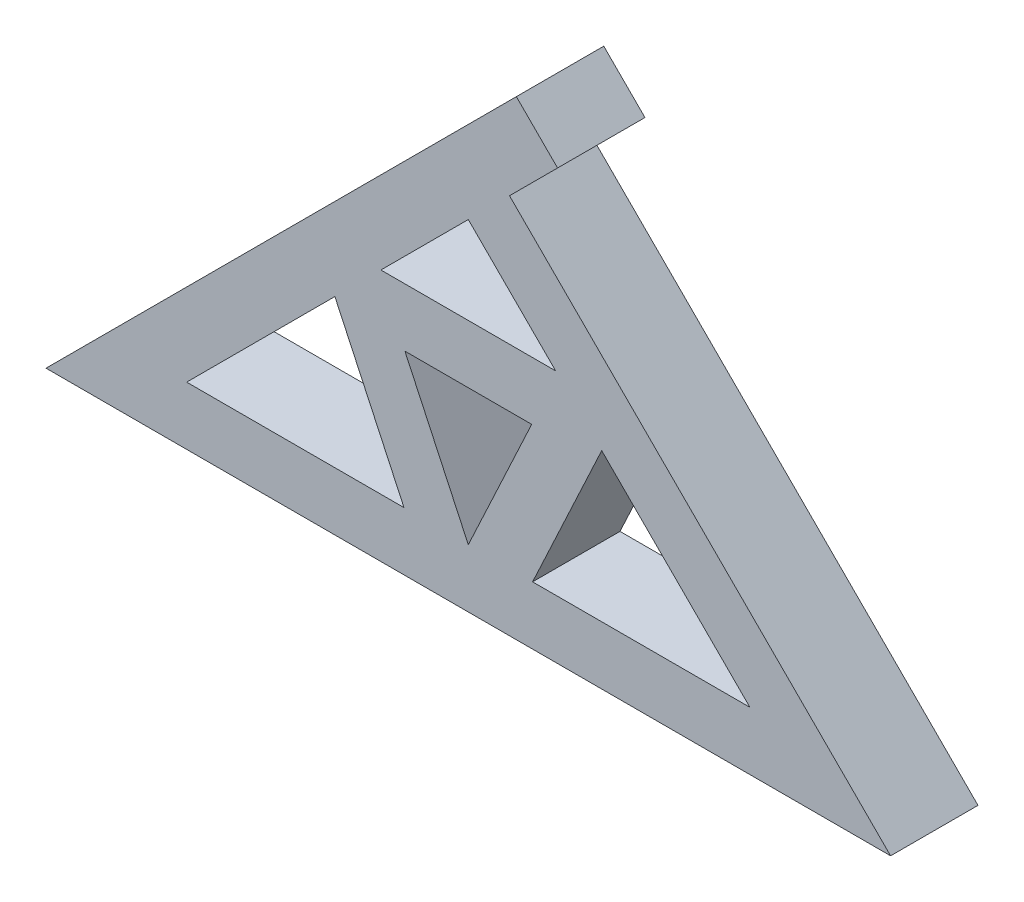
from build123d import *

# Parameters (mm, degrees)
BOSS_EXTRUDE1_DEPTH     = 9
SKETCH2_R               = 1.625
CUT_EXTRUDE3_DEPTH      = 9
SKETCH8_W               = 9
SKETCH8_H               = 7
SKETCH8_R               = 1.625
BOSS_EXTRUDE2_DEPTH     = 6
CUT_EXTRUDE4_DEPTH      = 33
CUT_EXTRUDE4_DEPTH_BACK = 3
SKETCH9_R               = 2.875


with BuildPart() as part:
    # Sketch1 → Boss-Extrude1 (new body)
    # profile 1 of 3: a face of its own
    with BuildSketch(Plane.XY):
        Polygon((86.974134086, 0), (43.487067043, 43.487067043), (0, 0), align=None)
        Polygon((43.487067043, 35.001785669), (72.488852712, 6), (14.485281374, 6), align=None, mode=Mode.SUBTRACT)
    # profile 2 of 3: a face of its own
    with BuildSketch(Plane.XY):
        Polygon((34.487067043, 26.001785669), (29.749143655, 21.263862281), (36.866799529, 6), (43.487067043, 6), (36.957927158, 20.001785669), (43.487067043, 20.001785669), (43.487067043, 26.001785669), align=None)
    # profile 3 of 3: a face of its own
    with BuildSketch(Plane.XY):
        Polygon((50.016206928, 20.001785669), (43.487067043, 6), (50.107334557, 6), (57.224990431, 21.263862281), (52.487067043, 26.001785669), (43.487067043, 26.001785669), (43.487067043, 20.001785669), align=None)
    extrude(amount=BOSS_EXTRUDE1_DEPTH)

    # Sketch2 → Cut-Extrude3 (cut)
    with BuildSketch(Plane(origin=(0, 0, 0), x_dir=(0, 0, 1), z_dir=(-0.7071067811865438, 0.7071067811865513, 0))):
        with Locations(Location((4.5, 9, 0), (0, 0, 270))):
            Circle(SKETCH2_R)
    extrude(amount=-CUT_EXTRUDE3_DEPTH, mode=Mode.SUBTRACT)

    # Sketch8 → Boss-Extrude2 (add)
    with BuildSketch(Plane(origin=(0, 0, 0), x_dir=(0, 0, 1), z_dir=(-0.7071067811865438, 0.7071067811865513, 0))):
        with Locations((4.5, 65)):
            Rectangle(SKETCH8_W, SKETCH8_H)
        with Locations(Location((4.5, 65, 0), (0, 0, 270))):
            Circle(SKETCH8_R, mode=Mode.SUBTRACT)
    extrude(amount=-BOSS_EXTRUDE2_DEPTH)

    # Sketch9 → Cut-Extrude4 (cut, two sides: drawn at the far end of the back side and taken through both)
    with BuildSketch(Plane(origin=(4.242640687, -4.242640687, 0), x_dir=(0, 0, -1), z_dir=(0.7071067811865438, -0.7071067811865512, 0)).offset(-CUT_EXTRUDE4_DEPTH_BACK)):
        with Locations(Location((-4.5, 65, 0), (0, 0, 270))):
            Circle(SKETCH9_R)
        with Locations(Location((-4.5, 9, 0), (0, 0, 270))):
            Circle(SKETCH9_R)
    extrude(amount=CUT_EXTRUDE4_DEPTH + CUT_EXTRUDE4_DEPTH_BACK, mode=Mode.SUBTRACT)


solid = part.part
